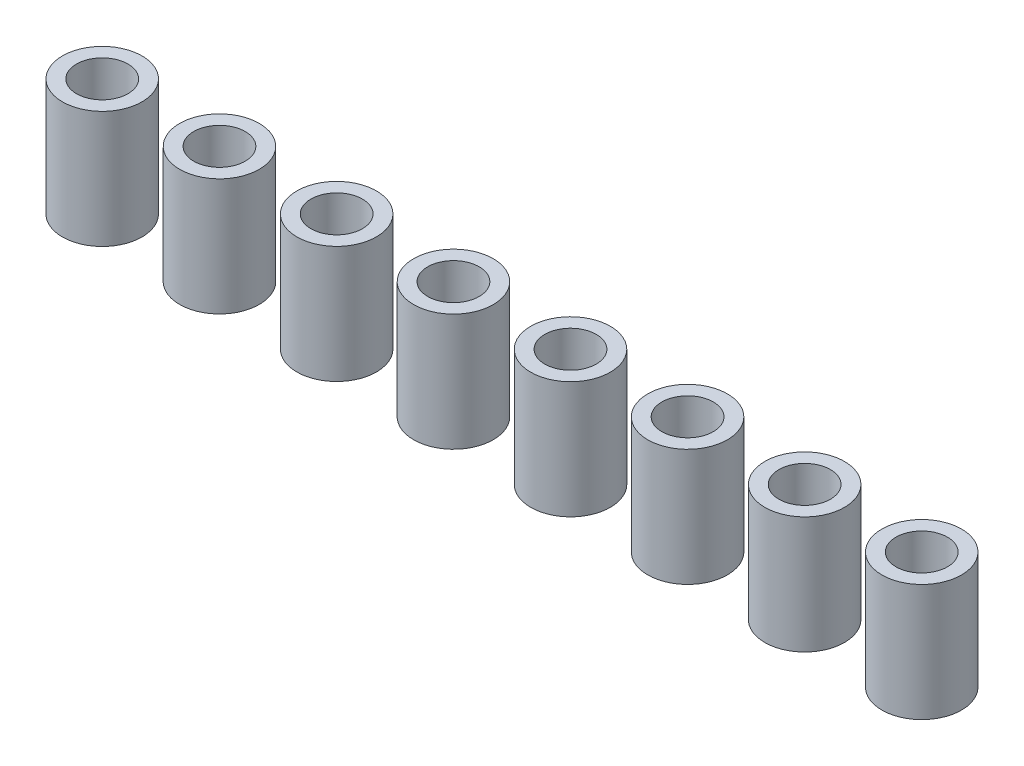
from build123d import *

# Parameters (mm, degrees)
SKETCH1_R             = 1.7
SKETCH1_R_2           = 1.1
BOSS_EXTRUDE1_DEPTH   = 5
BOSS_EXTRUDE1_2_DEPTH = 5
BOSS_EXTRUDE1_3_DEPTH = 5
BOSS_EXTRUDE1_4_DEPTH = 5
BOSS_EXTRUDE1_5_DEPTH = 5
BOSS_EXTRUDE1_6_DEPTH = 5
BOSS_EXTRUDE1_7_DEPTH = 5
BOSS_EXTRUDE1_8_DEPTH = 5


with BuildPart() as part:
    # Sketch1 → Boss-Extrude1 (new body)
    with BuildSketch(Plane(origin=(0, 0, 0), x_dir=(1, 0, 0), z_dir=(0, 1, 0))):
        with Locations(Location((0, 0, 0), (0, 0, 270))):
            Circle(SKETCH1_R)
        with Locations(Location((0, 0, 0), (0, 0, 270))):
            Circle(SKETCH1_R_2, mode=Mode.SUBTRACT)
    extrude(amount=BOSS_EXTRUDE1_DEPTH)


with BuildPart() as body_2:
    # Sketch1 → Boss-Extrude1 2 (new body)
    with BuildSketch(Plane(origin=(0, 0, 0), x_dir=(1, 0, 0), z_dir=(0, 1, 0))):
        with Locations(Location((5, 0.007080747, 0), (0, 0, 270))):
            Circle(SKETCH1_R)
        with Locations(Location((5, 0.007080747, 0), (0, 0, 270))):
            Circle(SKETCH1_R_2, mode=Mode.SUBTRACT)
    extrude(amount=BOSS_EXTRUDE1_2_DEPTH)


with BuildPart() as body_3:
    # Sketch1 → Boss-Extrude1 3 (new body)
    with BuildSketch(Plane(origin=(0, 0, 0), x_dir=(1, 0, 0), z_dir=(0, 1, 0))):
        with Locations(Location((10, 0.012235531, 0), (0, 0, 270))):
            Circle(SKETCH1_R)
        with Locations(Location((10, 0.012235531, 0), (0, 0, 270))):
            Circle(SKETCH1_R_2, mode=Mode.SUBTRACT)
    extrude(amount=BOSS_EXTRUDE1_3_DEPTH)


with BuildPart() as body_4:
    # Sketch1 → Boss-Extrude1 4 (new body)
    with BuildSketch(Plane(origin=(0, 0, 0), x_dir=(1, 0, 0), z_dir=(0, 1, 0))):
        with Locations(Location((15, 0, 0), (0, 0, 270))):
            Circle(SKETCH1_R)
        with Locations(Location((15, 0, 0), (0, 0, 270))):
            Circle(SKETCH1_R_2, mode=Mode.SUBTRACT)
    extrude(amount=BOSS_EXTRUDE1_4_DEPTH)


with BuildPart() as body_5:
    # Sketch1 → Boss-Extrude1 5 (new body)
    with BuildSketch(Plane(origin=(0, 0, 0), x_dir=(1, 0, 0), z_dir=(0, 1, 0))):
        with Locations(Location((20, 0, 0), (0, 0, 270))):
            Circle(SKETCH1_R)
        with Locations(Location((20, 0, 0), (0, 0, 270))):
            Circle(SKETCH1_R_2, mode=Mode.SUBTRACT)
    extrude(amount=BOSS_EXTRUDE1_5_DEPTH)


with BuildPart() as body_6:
    # Sketch1 → Boss-Extrude1 6 (new body)
    with BuildSketch(Plane(origin=(0, 0, 0), x_dir=(1, 0, 0), z_dir=(0, 1, 0))):
        with Locations(Location((25, 0, 0), (0, 0, 270))):
            Circle(SKETCH1_R)
        with Locations(Location((25, 0, 0), (0, 0, 270))):
            Circle(SKETCH1_R_2, mode=Mode.SUBTRACT)
    extrude(amount=BOSS_EXTRUDE1_6_DEPTH)


with BuildPart() as body_7:
    # Sketch1 → Boss-Extrude1 7 (new body)
    with BuildSketch(Plane(origin=(0, 0, 0), x_dir=(1, 0, 0), z_dir=(0, 1, 0))):
        with Locations(Location((30, 0, 0), (0, 0, 270))):
            Circle(SKETCH1_R)
        with Locations(Location((30, 0, 0), (0, 0, 270))):
            Circle(SKETCH1_R_2, mode=Mode.SUBTRACT)
    extrude(amount=BOSS_EXTRUDE1_7_DEPTH)


with BuildPart() as body_8:
    # Sketch1 → Boss-Extrude1 8 (new body)
    with BuildSketch(Plane(origin=(0, 0, 0), x_dir=(1, 0, 0), z_dir=(0, 1, 0))):
        with Locations(Location((35, 0, 0), (0, 0, 270))):
            Circle(SKETCH1_R)
        with Locations(Location((35, 0, 0), (0, 0, 270))):
            Circle(SKETCH1_R_2, mode=Mode.SUBTRACT)
    extrude(amount=BOSS_EXTRUDE1_8_DEPTH)


solid = Compound([part.part, body_2.part, body_3.part, body_4.part, body_5.part, body_6.part, body_7.part, body_8.part])
